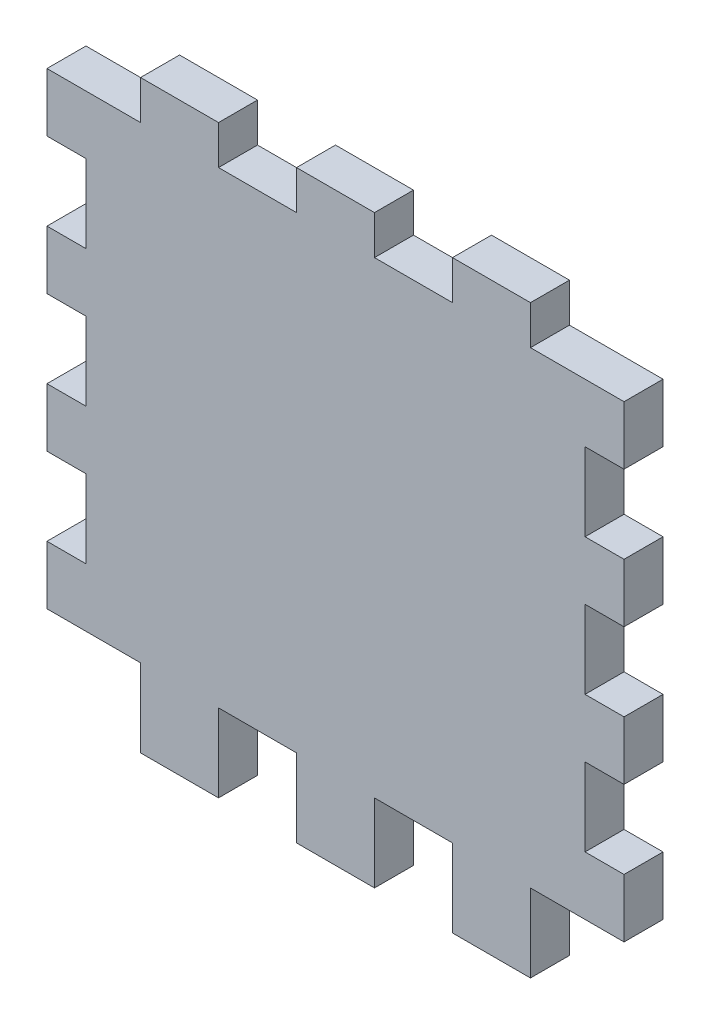
from build123d import *

# Parameters (mm, degrees)
BOSS_EXTRUDE1_DEPTH = 2.5


with BuildPart() as part:
    # Sketch1 → Boss-Extrude1 (new body)
    with BuildSketch(Plane.XY):
        Polygon((2.5, -20), (2.5, -15), (7.5, -15), (7.5, -20), (12.5, -20), (12.5, -15), (18.5, -15), (18.5, -11.25), (16, -11.25), (16, -6.25), (18.5, -6.25), (18.5, -2.5), (16, -2.5), (16, 2.5), (18.5, 2.5), (18.5, 6.25), (16, 6.25), (16, 11.25), (18.5, 11.25), (18.5, 15), (12.5, 15), (12.5, 17.5), (7.5, 17.5), (7.5, 15), (2.5, 15), (2.5, 17.5), (-2.5, 17.5), (-2.5, 15), (-7.5, 15), (-7.5, 17.5), (-12.5, 17.5), (-12.5, 15), (-18.5, 15), (-18.5, 11.25), (-16, 11.25), (-16, 6.25), (-18.5, 6.25), (-18.5, 2.5), (-16, 2.5), (-16, -2.5), (-18.5, -2.5), (-18.5, -6.25), (-16, -6.25), (-16, -11.25), (-18.5, -11.25), (-18.5, -15), (-12.5, -15), (-12.5, -20), (-7.5, -20), (-7.5, -15), (-2.5, -15), (-2.5, -20), align=None)
    extrude(amount=BOSS_EXTRUDE1_DEPTH)


solid = part.part
